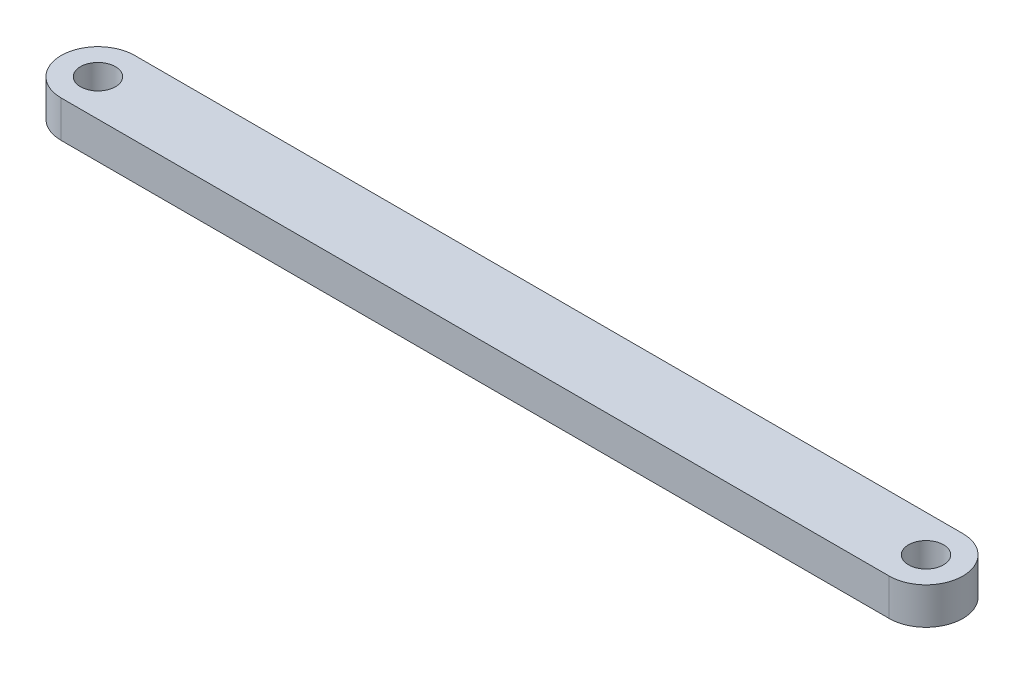
from build123d import *

# Parameters (mm, degrees)
SKETCH1_R           = 0.95
BOSS_EXTRUDE1_DEPTH = 1


with BuildPart() as part:
    # Sketch1 → Boss-Extrude1 (new, symmetric)
    with BuildSketch(Plane(origin=(0, 0, 0), x_dir=(1, 0, 0), z_dir=(0, 1, 0))):
        with BuildLine():
            Line((22.5, -2), (-22.5, -2))
            ThreePointArc((-22.5, -2), (-24.5, 0), (-22.5, 2))
            Line((-22.5, 2), (22.5, 2))
            ThreePointArc((22.5, 2), (24.5, 0), (22.5, -2))
        make_face()
        with Locations(Location((-22.5, 0, 0), (0, 0, 270))):
            Circle(SKETCH1_R, mode=Mode.SUBTRACT)
        with Locations(Location((22.5, 0, 0), (0, 0, 270))):
            Circle(SKETCH1_R, mode=Mode.SUBTRACT)
    extrude(amount=BOSS_EXTRUDE1_DEPTH, both=True)


solid = part.part
